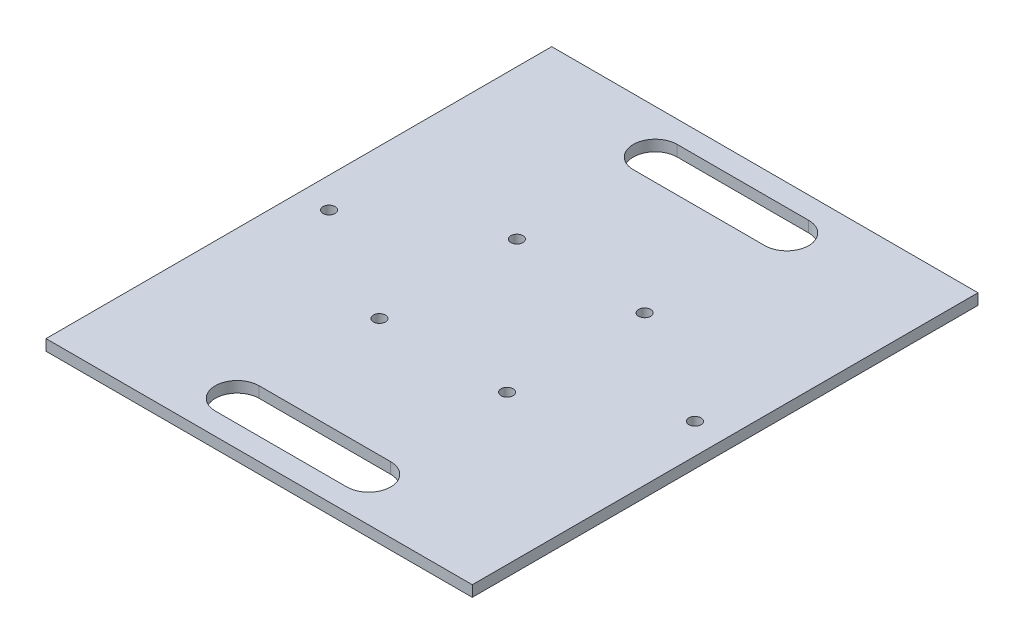
from build123d import *

# Parameters (mm, degrees)
SKETCH1_W         = 247
SKETCH1_H         = 293
MAIN_BASE_DEPTH   = 3.175
HANDLES_DEPTH     = 192.715472772
ALIGNMENT_HOLES_D = 6.99999997


with BuildPart() as part:
    # Sketch1 → Main Base (new, symmetric)
    with BuildSketch(Plane(origin=(0, 0, 0), x_dir=(1, 0, 0), z_dir=(0, 1, 0))):
        Rectangle(SKETCH1_W, SKETCH1_H)
    extrude(amount=MAIN_BASE_DEPTH, both=True)

    # Sketch2 → Handles (cut, through all)
    with BuildSketch(Plane(origin=(0, 3.175, 0), x_dir=(1, 0, 0), z_dir=(0, 1, 0))):
        with BuildLine():
            Line((-38.1, 133.8), (38.1, 133.8))
            ThreePointArc((38.1, 133.8), (50.8, 121.1), (38.1, 108.4))
            Line((38.1, 108.4), (-38.1, 108.4))
            ThreePointArc((-38.1, 108.4), (-50.8, 121.1), (-38.1, 133.8))
        make_face()
        with BuildLine():
            Line((-38.1, -133.8), (38.1, -133.8))
            ThreePointArc((38.1, -133.8), (50.8, -121.1), (38.1, -108.4))
            Line((38.1, -108.4), (-38.1, -108.4))
            ThreePointArc((-38.1, -108.4), (-50.8, -121.1), (-38.1, -133.8))
        make_face()
    extrude(amount=-HANDLES_DEPTH, mode=Mode.SUBTRACT)

    # Alignment Holes (through all)
    with Locations(Plane(origin=(0, 3.175, 0), x_dir=(1, 0, 0), z_dir=(0, 1, 0))):
        with Locations((-106, 0), (-37, -39.837168574), (-37, 39.837168574), (37, 39.837168574), (37, -39.837168574), (106, 0)):
            Hole(ALIGNMENT_HOLES_D / 2)


solid = part.part
